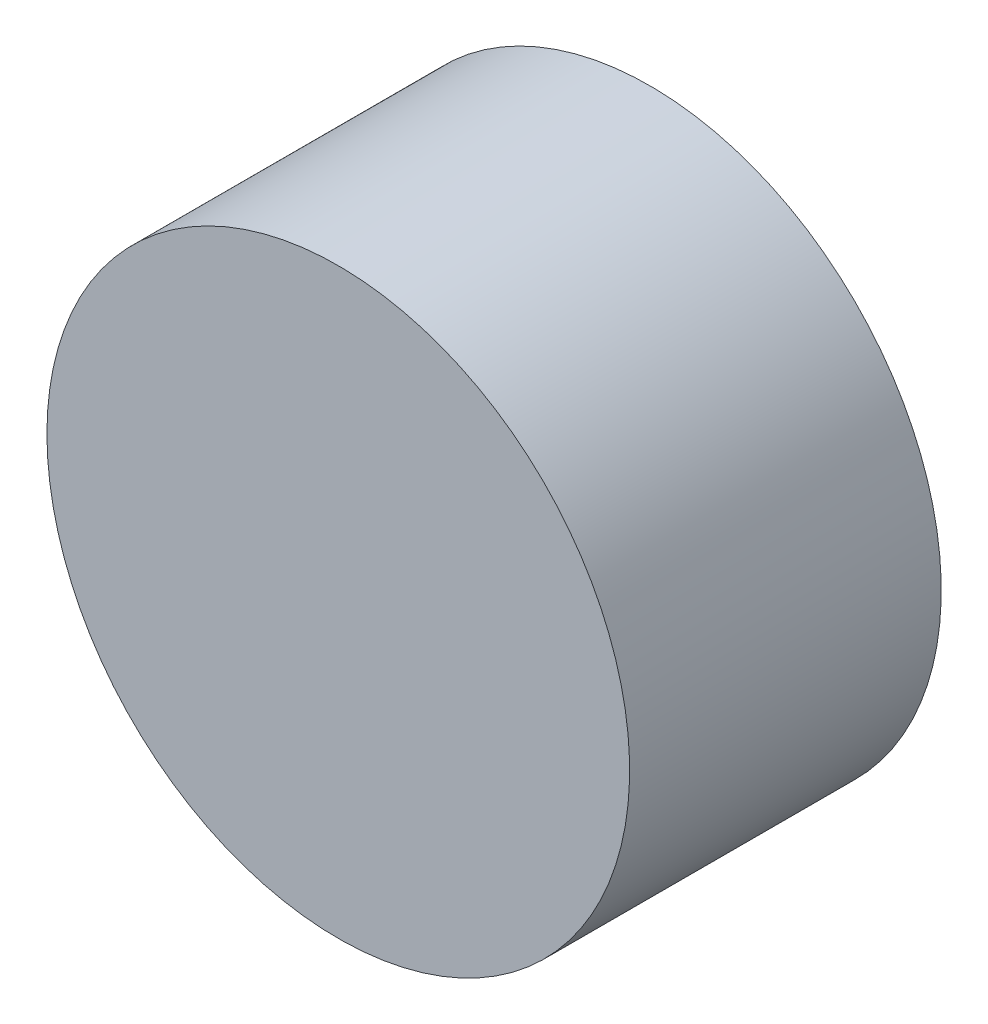
from build123d import *

# Parameters (mm, degrees)
SKETCH2_R           = 42.075
BOSS_EXTRUDE1_DEPTH = 45


with BuildPart() as part:
    # Sketch2 → Boss-Extrude1 (new body)
    with BuildSketch(Plane.XY):
        with Locations(Location((0, 0, 0), (0, 0, 180))):
            Circle(SKETCH2_R)
    extrude(amount=BOSS_EXTRUDE1_DEPTH)


solid = part.part
